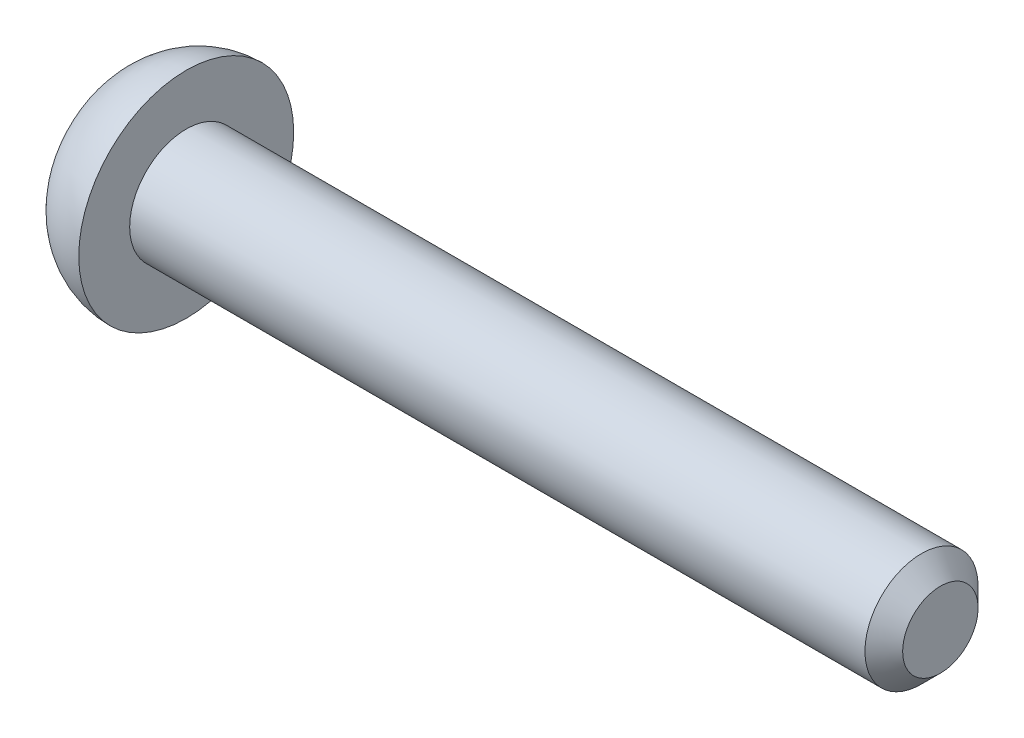
from build123d import *

# Parameters (mm, degrees)
CHAMFER1_SIZE      = 0.5
CUT_EXTRUDE1_DEPTH = 1


with BuildPart() as part:
    # Sketch2 → Revolve1 (revolve)
    with BuildSketch(Plane(origin=(0, 0, 0), x_dir=(1, 0, 0), z_dir=(0, 1, 0)), mode=Mode.PRIVATE) as revolve1_sk:
        with BuildLine():
            Line((0, 0), (0, 1.5))
            Line((0, 1.5), (-20, 1.5))
            Line((-20, 1.5), (-20, 2.85))
            ThreePointArc((-20, 2.85), (-20.917065968, 2.639177072), (-21.65, 2.049038106))
            Line((-21.65, 2.049038106), (-21.65, 0))
            Line((-21.65, 0), (0, 0))
        make_face()
    revolve(revolve1_sk.sketch.rotate(Axis((-21.65, 0, 0), (1, 0, 0)), 180), axis=Axis((-21.65, 0, 0), (1, 0, 0)))

    # Chamfer1
    chamfer1_edges = [part.edges().sort_by_distance(p)[0] for p in [
        (0, 0, -1.5),
    ]]
    chamfer(chamfer1_edges, length=CHAMFER1_SIZE)

    # Sketch4 → Cut-Extrude1 (cut)
    with BuildSketch(Plane.ZY.offset(21.65)):
        with BuildLine():
            ThreePointArc((-1.342027284, 0.090739778), (-0.883315009, 0.509982158), (-0.749596595, 1.116859832))
            ThreePointArc((-0.749596595, 1.116859832), (-0.7, 1.212435565), (-0.592430689, 1.20759961))
            ThreePointArc((-0.592430689, 1.20759961), (0, 1.019964317), (0.592430689, 1.20759961))
            ThreePointArc((0.592430689, 1.20759961), (0.7, 1.212435565), (0.749596595, 1.116859832))
            ThreePointArc((0.749596595, 1.116859832), (0.883315009, 0.509982158), (1.342027284, 0.090739778))
            ThreePointArc((1.342027284, 0.090739778), (1.4, 0), (1.342027284, -0.090739778))
            ThreePointArc((1.342027284, -0.090739778), (0.883315009, -0.509982158), (0.749596595, -1.116859832))
            ThreePointArc((0.749596595, -1.116859832), (0.7, -1.212435565), (0.592430689, -1.20759961))
            ThreePointArc((0.592430689, -1.20759961), (0, -1.019964317), (-0.592430689, -1.20759961))
            ThreePointArc((-0.592430689, -1.20759961), (-0.7, -1.212435565), (-0.749596595, -1.116859832))
            ThreePointArc((-0.749596595, -1.116859832), (-0.883315009, -0.509982158), (-1.342027284, -0.090739778))
            ThreePointArc((-1.342027284, -0.090739778), (-1.4, 0), (-1.342027284, 0.090739778))
        make_face()
    extrude(amount=-CUT_EXTRUDE1_DEPTH, mode=Mode.SUBTRACT)


solid = part.part
